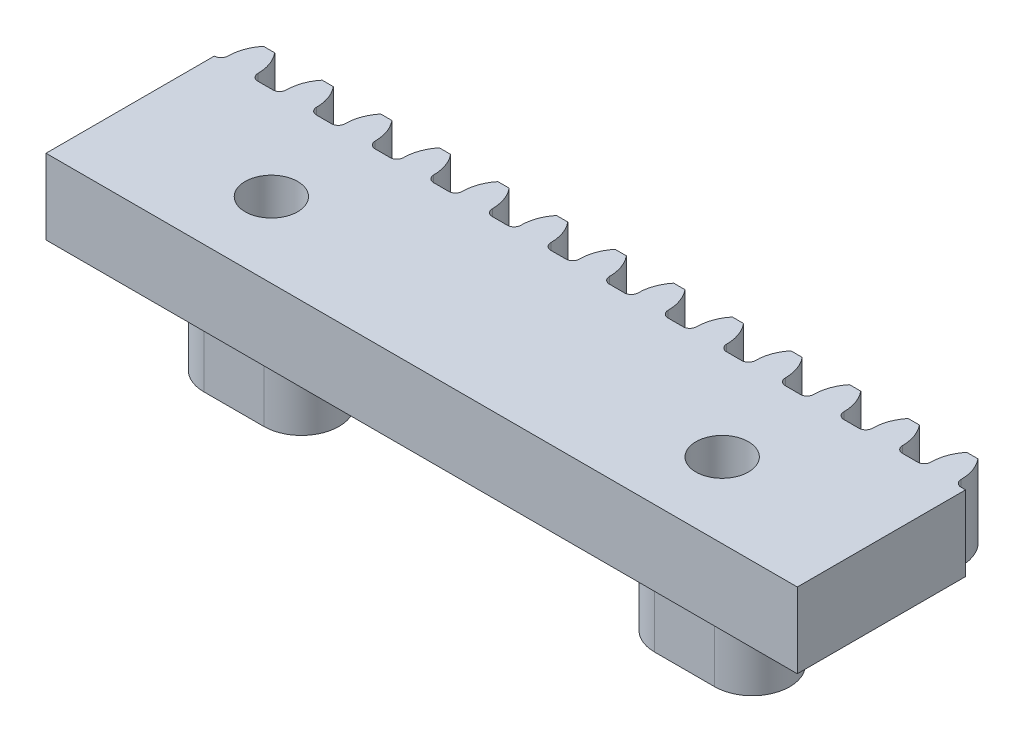
from build123d import *

# Parameters (mm, degrees)
BOSS_EXTRUDE1_DEPTH = 5
SKETCH2_R           = 1.75
BOSS_EXTRUDE2_DEPTH = 6
CUT_EXTRUDE1_REACH  = 54.111
SKETCH3_R           = 1.75


with BuildPart() as part:
    # Sketch1 → Boss-Extrude1 (new body)
    with BuildSketch(Plane(origin=(0, 0, 0), x_dir=(1, 0, 0), z_dir=(0, 1, 0))):
        with BuildLine():
            Line((0, 0), (50, 0))
            Line((50, 0), (50, 11.2))
            Line((50, 11.2), (49.7, 11.2))
            ThreePointArc((49.7, 11.2), (49.38158785, 11.33158785), (49.25, 11.65))
            ThreePointArc((49.25, 11.65), (49.089793883, 12.579390672), (48.625, 13.4))
            Line((48.625, 13.4), (47.875, 13.4))
            ThreePointArc((47.875, 13.4), (47.410206117, 12.579390672), (47.25, 11.65))
            ThreePointArc((47.25, 11.65), (47.11841215, 11.33158785), (46.8, 11.2))
            Line((46.8, 11.2), (45.8, 11.2))
            ThreePointArc((45.8, 11.2), (45.48158785, 11.33158785), (45.35, 11.65))
            ThreePointArc((45.35, 11.65), (45.189793883, 12.579390672), (44.725, 13.4))
            Line((44.725, 13.4), (43.975, 13.4))
            ThreePointArc((43.975, 13.4), (43.510206117, 12.579390672), (43.35, 11.65))
            ThreePointArc((43.35, 11.65), (43.21841215, 11.33158785), (42.9, 11.2))
            Line((42.9, 11.2), (41.9, 11.2))
            ThreePointArc((41.9, 11.2), (41.58158785, 11.33158785), (41.45, 11.65))
            ThreePointArc((41.45, 11.65), (41.289793883, 12.579390672), (40.825, 13.4))
            Line((40.825, 13.4), (40.075, 13.4))
            ThreePointArc((40.075, 13.4), (39.610206117, 12.579390672), (39.45, 11.65))
            ThreePointArc((39.45, 11.65), (39.31841215, 11.33158785), (39, 11.2))
            Line((39, 11.2), (38, 11.2))
            ThreePointArc((38, 11.2), (37.68158785, 11.33158785), (37.55, 11.65))
            ThreePointArc((37.55, 11.65), (37.389793883, 12.579390672), (36.925, 13.4))
            Line((36.925, 13.4), (36.175, 13.4))
            ThreePointArc((36.175, 13.4), (35.710206117, 12.579390672), (35.55, 11.65))
            ThreePointArc((35.55, 11.65), (35.41841215, 11.33158785), (35.1, 11.2))
            Line((35.1, 11.2), (34.1, 11.2))
            ThreePointArc((34.1, 11.2), (33.78158785, 11.33158785), (33.65, 11.65))
            ThreePointArc((33.65, 11.65), (33.489793883, 12.579390672), (33.025, 13.4))
            Line((33.025, 13.4), (32.275, 13.4))
            ThreePointArc((32.275, 13.4), (31.810206117, 12.579390672), (31.65, 11.65))
            ThreePointArc((31.65, 11.65), (31.51841215, 11.33158785), (31.2, 11.2))
            Line((31.2, 11.2), (30.2, 11.2))
            ThreePointArc((30.2, 11.2), (29.88158785, 11.33158785), (29.75, 11.65))
            ThreePointArc((29.75, 11.65), (29.589793883, 12.579390672), (29.125, 13.4))
            Line((29.125, 13.4), (28.375, 13.4))
            ThreePointArc((28.375, 13.4), (27.910206117, 12.579390672), (27.75, 11.65))
            ThreePointArc((27.75, 11.65), (27.61841215, 11.33158785), (27.3, 11.2))
            Line((27.3, 11.2), (26.3, 11.2))
            ThreePointArc((26.3, 11.2), (25.98158785, 11.33158785), (25.85, 11.65))
            ThreePointArc((25.85, 11.65), (25.689793883, 12.579390672), (25.225, 13.4))
            Line((25.225, 13.4), (24.475, 13.4))
            ThreePointArc((24.475, 13.4), (24.010206117, 12.579390672), (23.85, 11.65))
            ThreePointArc((23.85, 11.65), (23.71841215, 11.33158785), (23.4, 11.2))
            Line((23.4, 11.2), (22.4, 11.2))
            ThreePointArc((22.4, 11.2), (22.08158785, 11.33158785), (21.95, 11.65))
            ThreePointArc((21.95, 11.65), (21.789793883, 12.579390672), (21.325, 13.4))
            Line((21.325, 13.4), (20.575, 13.4))
            ThreePointArc((20.575, 13.4), (20.110206117, 12.579390672), (19.95, 11.65))
            ThreePointArc((19.95, 11.65), (19.81841215, 11.33158785), (19.5, 11.2))
            Line((19.5, 11.2), (18.5, 11.2))
            ThreePointArc((18.5, 11.2), (18.18158785, 11.33158785), (18.05, 11.65))
            ThreePointArc((18.05, 11.65), (17.889793883, 12.579390672), (17.425, 13.4))
            Line((17.425, 13.4), (16.675, 13.4))
            ThreePointArc((16.675, 13.4), (16.210206117, 12.579390672), (16.05, 11.65))
            ThreePointArc((16.05, 11.65), (15.91841215, 11.33158785), (15.6, 11.2))
            Line((15.6, 11.2), (14.6, 11.2))
            ThreePointArc((14.6, 11.2), (14.28158785, 11.33158785), (14.15, 11.65))
            ThreePointArc((14.15, 11.65), (13.989793883, 12.579390672), (13.525, 13.4))
            Line((13.525, 13.4), (12.775, 13.4))
            ThreePointArc((12.775, 13.4), (12.310206117, 12.579390672), (12.15, 11.65))
            ThreePointArc((12.15, 11.65), (12.01841215, 11.33158785), (11.7, 11.2))
            Line((11.7, 11.2), (10.7, 11.2))
            ThreePointArc((10.7, 11.2), (10.38158785, 11.33158785), (10.25, 11.65))
            ThreePointArc((10.25, 11.65), (10.089793883, 12.579390672), (9.625, 13.4))
            Line((9.625, 13.4), (8.875, 13.4))
            ThreePointArc((8.875, 13.4), (8.410206117, 12.579390672), (8.25, 11.65))
            ThreePointArc((8.25, 11.65), (8.11841215, 11.33158785), (7.8, 11.2))
            Line((7.8, 11.2), (6.8, 11.2))
            ThreePointArc((6.8, 11.2), (6.48158785, 11.33158785), (6.35, 11.65))
            ThreePointArc((6.35, 11.65), (6.189793883, 12.579390672), (5.725, 13.4))
            Line((5.725, 13.4), (4.975, 13.4))
            ThreePointArc((4.975, 13.4), (4.510206117, 12.579390672), (4.35, 11.65))
            ThreePointArc((4.35, 11.65), (4.21841215, 11.33158785), (3.9, 11.2))
            Line((3.9, 11.2), (2.9, 11.2))
            ThreePointArc((2.9, 11.2), (2.58158785, 11.33158785), (2.45, 11.65))
            ThreePointArc((2.45, 11.65), (2.289793883, 12.579390672), (1.825, 13.4))
            Line((1.825, 13.4), (1.075, 13.4))
            ThreePointArc((1.075, 13.4), (0.610206117, 12.579390672), (0.45, 11.65))
            ThreePointArc((0.45, 11.65), (0.31841215, 11.33158785), (0, 11.2))
            Line((0, 11.2), (0, 0))
        make_face()
    extrude(amount=BOSS_EXTRUDE1_DEPTH)

    # Sketch2 → Boss-Extrude2 (add)
    # profile 1 of 2: a face of its own
    with BuildSketch(Plane.XZ):
        with BuildLine():
            Line((12, -7.5), (8, -7.5))
            ThreePointArc((8, -7.5), (5.5, -5), (8, -2.5))
            Line((8, -2.5), (12, -2.5))
            ThreePointArc((12, -2.5), (14.5, -5), (12, -7.5))
        make_face()
        with Locations(Location((10, -5, 0), (0, 0, 270))):
            Circle(SKETCH2_R, mode=Mode.SUBTRACT)
    # profile 2 of 2: a face of its own
    with BuildSketch(Plane.XZ):
        with BuildLine():
            Line((42, -7.5), (38, -7.5))
            ThreePointArc((38, -7.5), (35.5, -5), (38, -2.5))
            Line((38, -2.5), (42, -2.5))
            ThreePointArc((42, -2.5), (44.5, -5), (42, -7.5))
        make_face()
        with Locations(Location((40, -5, 0), (0, 0, 270))):
            Circle(SKETCH2_R, mode=Mode.SUBTRACT)
    extrude(amount=BOSS_EXTRUDE2_DEPTH)

    # Sketch3 → Cut-Extrude1 (cut, up to next)
    with BuildSketch(Plane.XZ, mode=Mode.PRIVATE) as cut_extrude1_sk1:
        with Locations(Location((40, -5, 0), (0, 0, 270))):
            Circle(SKETCH3_R)
    cut_extrude1_tool1 = extrude(cut_extrude1_sk1.sketch, amount=-CUT_EXTRUDE1_REACH, mode=Mode.PRIVATE) & part.part
    # Sketch3 → Cut-Extrude1 (cut, up to next)
    with BuildSketch(Plane.XZ, mode=Mode.PRIVATE) as cut_extrude1_sk2:
        with Locations(Location((10, -5, 0), (0, 0, 270))):
            Circle(SKETCH3_R)
    cut_extrude1_tool2 = extrude(cut_extrude1_sk2.sketch, amount=-CUT_EXTRUDE1_REACH, mode=Mode.PRIVATE) & part.part
    add(cut_extrude1_tool1.solids().sort_by_distance((40, 0, -5))[0], mode=Mode.SUBTRACT)
    add(cut_extrude1_tool2.solids().sort_by_distance((10, 0, -5))[0], mode=Mode.SUBTRACT)


solid = part.part
